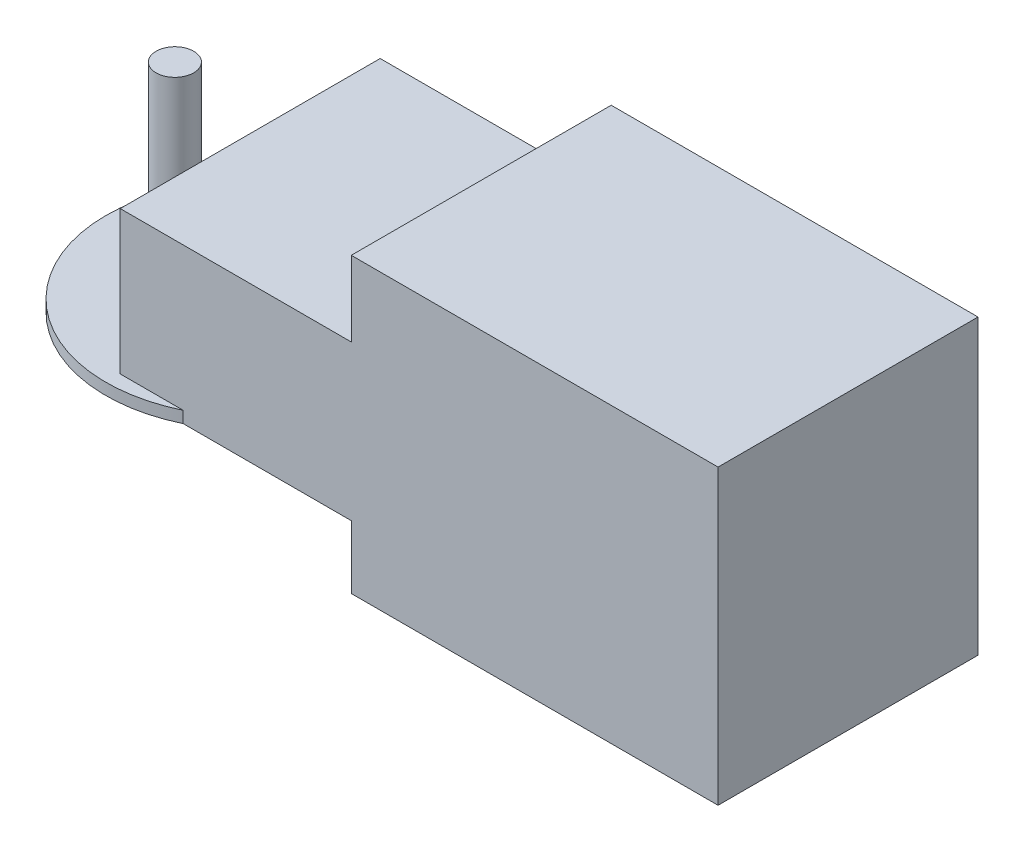
from build123d import *

# Parameters (mm, degrees)
BOSS_EXTRUDE2_DEPTH = 40
SKETCH3_W           = 63.5
SKETCH3_H           = 50.713358162
BOSS_EXTRUDE3_DEPTH = 5
SKETCH5_W           = 40
SKETCH5_H           = 26.795354342
BOSS_EXTRUDE4_DEPTH = 45
SKETCH7_R           = 25
BOSS_EXTRUDE6_DEPTH = 2
SKETCH11_R          = 6
BOSS_EXTRUDE7_DEPTH = 6
SKETCH13_R          = 3.25
BOSS_EXTRUDE8_DEPTH = 25


with BuildPart() as part:
    # Sketch1 → Boss-Extrude2 (new body)
    with BuildSketch(Plane.XY):
        with BuildLine():
            ThreePointArc((5.08, 33.118635635), (0, 52.077453737), (-5.08, 33.118635635))
            Line((-5.08, 33.118635635), (-21.263810414, 5.087453737))
            Line((-21.263810414, 5.087453737), (-26.343810414, 5.087453737))
            Line((-26.343810414, 5.087453737), (-26.343810414, 6.865453737))
            Line((-26.343810414, 6.865453737), (-31.75, 6.865453737))
            Line((-31.75, 6.865453737), (-31.75, 57.578811899))
            Line((-31.75, 57.578811899), (31.75, 57.578811899))
            Line((31.75, 57.578811899), (31.75, 6.865453737))
            Line((31.75, 6.865453737), (26.343810414, 6.865453737))
            Line((26.343810414, 6.865453737), (26.343810414, 5.087453737))
            Line((26.343810414, 5.087453737), (21.263810414, 5.087453737))
            Line((21.263810414, 5.087453737), (5.08, 33.118635635))
        make_face()
    extrude(amount=BOSS_EXTRUDE2_DEPTH)

    # Sketch3 → Boss-Extrude3 (add)
    with BuildSketch(Plane.XY.offset(40)):
        with Locations((0, 32.222132818)):
            Rectangle(SKETCH3_W, SKETCH3_H)
    extrude(amount=BOSS_EXTRUDE3_DEPTH)

    # Sketch5 → Boss-Extrude4 (add)
    with BuildSketch(Plane.XY.offset(45)):
        with Locations((-51.75, 31.186442922)):
            Rectangle(SKETCH5_W, SKETCH5_H)
    extrude(amount=-BOSS_EXTRUDE4_DEPTH)

    # Sketch7 → Boss-Extrude6 (add)
    with BuildSketch(Plane.XZ.offset(-17.788765751)):
        with Locations((-71.75, 22.5)):
            Circle(SKETCH7_R)
    extrude(amount=-BOSS_EXTRUDE6_DEPTH)

    # Sketch11 → Boss-Extrude7 (add)
    with BuildSketch(Plane(origin=(0, 17.788765751, 0), x_dir=(-1, 0, 0), z_dir=(0, -1, 0))):
        with Locations(Location((84.7850913, -22.5, 0), (0, 0, 90))):
            Circle(SKETCH11_R)
    extrude(amount=-BOSS_EXTRUDE7_DEPTH)

    # Sketch13 → Boss-Extrude8 (add)
    with BuildSketch(Plane(origin=(0, 23.788765751, 0), x_dir=(1, 0, 0), z_dir=(0, 1, 0))):
        with Locations(Location((-84.7850913, -22.5, 0), (0, 0, 270))):
            Circle(SKETCH13_R)
    extrude(amount=BOSS_EXTRUDE8_DEPTH)


solid = part.part
